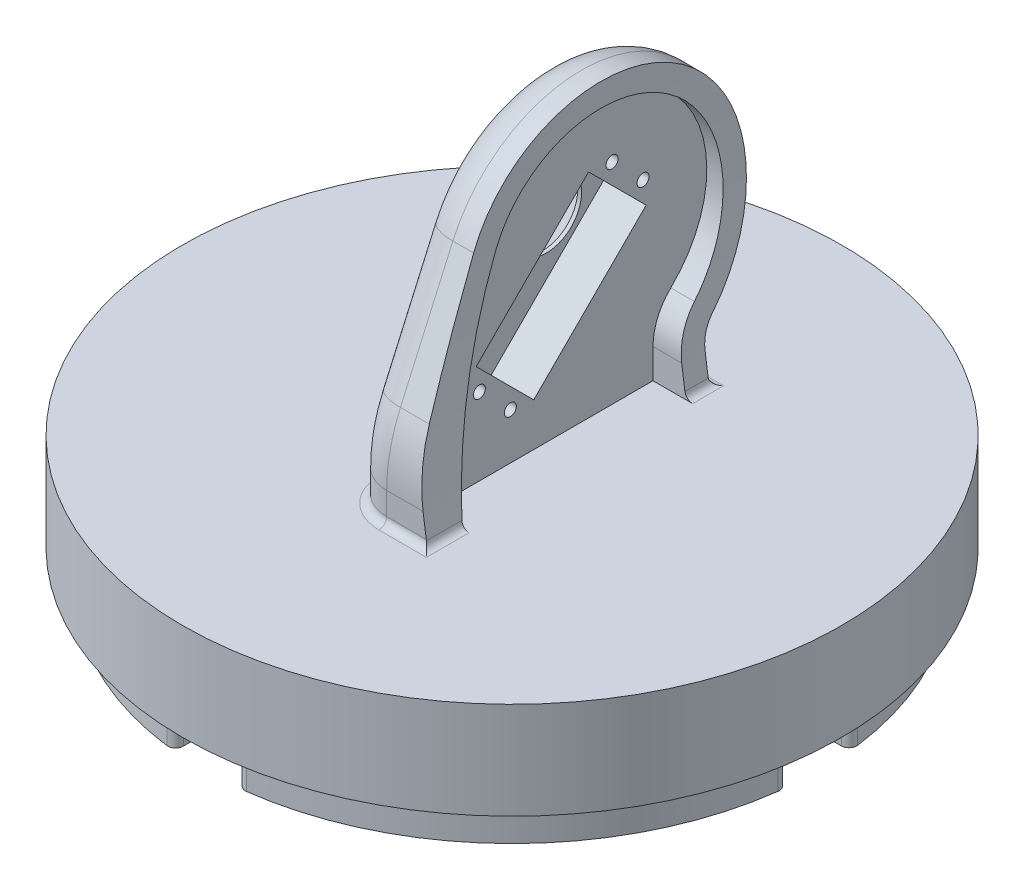
from build123d import *

# Parameters (mm, degrees)
SKETCH1_R                       = 85
BOSS_EXTRUDE1_DEPTH             = 25
BOSS_EXTRUDE2_DEPTH             = 10
FILLET1_R                       = 2
SKETCH3_R                       = 9
BOSS_EXTRUDE3_DEPTH             = 6
CUT_EXTRUDE1_DEPTH              = 151.982311708
CUT_EXTRUDE1_DEPTH_BACK         = 157.982311708
CUT_EXTRUDE1_START              = 6
SKETCH4_R                       = 1.55
BOSS_EXTRUDE5_DEPTH             = 9
BOSS_EXTRUDE5_DIRECTION_2_REACH = 158.982
CUT_EXTRUDE9_DEPTH              = 158.386549836
CUT_EXTRUDE9_DEPTH_BACK         = 158.386549836
FILLET3_R                       = 10
FILLET4_R                       = 2
FILLET5_R                       = 2
CUT_EXTRUDE11_DEPTH             = 11


with BuildPart() as part:
    # Sketch1 → Boss-Extrude1 (new body)
    with BuildSketch(Plane(origin=(0, 0, 0), x_dir=(1, 0, 0), z_dir=(0, 1, 0))):
        with Locations(Location((0, 0, 0), (0, 0, 270))):
            Circle(SKETCH1_R)
    extrude(amount=BOSS_EXTRUDE1_DEPTH)

    # Sketch2 → Boss-Extrude2 (add)
    with BuildSketch(Plane.XZ):
        with BuildLine():
            Line((-7.937838503, 79.102722582), (-7.943370347, 72.063533549))
            ThreePointArc((-7.943370347, 72.063533549), (-51.22493832, 51.305513292), (-72.050959732, 8.056624713))
            Line((-72.050959732, 8.056624713), (-79.090148765, 8.062156557))
            ThreePointArc((-79.090148765, 8.062156557), (-56.170794433, 56.259149058), (-7.937838503, 79.102722582))
        make_face()
        with BuildLine():
            Line((-79.102722582, -7.937838503), (-72.063533549, -7.943370347))
            ThreePointArc((-72.063533549, -7.943370347), (-51.305513292, -51.22493832), (-8.056624713, -72.050959732))
            Line((-8.056624713, -72.050959732), (-8.062156557, -79.090148765))
            ThreePointArc((-8.062156557, -79.090148765), (-56.259149058, -56.170794433), (-79.102722582, -7.937838503))
        make_face()
        with BuildLine():
            Line((8.062156557, 79.090148765), (8.056624713, 72.050959732))
            ThreePointArc((8.056624713, 72.050959732), (51.305513292, 51.22493832), (72.063533549, 7.943370347))
            Line((72.063533549, 7.943370347), (79.102722582, 7.937838503))
            ThreePointArc((79.102722582, 7.937838503), (56.259149058, 56.170794433), (8.062156557, 79.090148765))
        make_face()
        with BuildLine():
            Line((72.050959732, -8.056624713), (79.090148765, -8.062156557))
            ThreePointArc((79.090148765, -8.062156557), (56.170794433, -56.259149058), (7.937838503, -79.102722582))
            Line((7.937838503, -79.102722582), (7.943370347, -72.063533549))
            ThreePointArc((7.943370347, -72.063533549), (51.22493832, -51.305513292), (72.050959732, -8.056624713))
        make_face()
    extrude(amount=BOSS_EXTRUDE2_DEPTH)

    # Fillet1
    fillet1_edges = [part.edges().sort_by_distance(p)[0] for p in [
        (79.102722582, -5, 7.937838503),
        (8.062156557, -5, 79.090148765),
        (8.056624713, -5, 72.050959732),
        (72.063533549, -5, 7.943370347),
        (7.937838503, -5, -79.102722582),
        (79.090148765, -5, -8.062156557),
        (72.050959732, -5, -8.056624713),
        (7.943370347, -5, -72.063533549),
        (-79.102722582, -5, -7.937838503),
        (-8.062156557, -5, -79.090148765),
        (-8.056624713, -5, -72.050959732),
        (-72.063533549, -5, -7.943370347),
        (-7.937838503, -5, 79.102722582),
        (-79.090148765, -5, 8.062156557),
        (-72.050959732, -5, 8.056624713),
        (-7.943370347, -5, 72.063533549),
    ]]
    fillet(fillet1_edges, radius=FILLET1_R)

    # Sketch3 → Boss-Extrude3 (add, symmetric)
    with BuildSketch(Plane(origin=(0, 0, 0), x_dir=(0, 0, -1), z_dir=(1, 0, 0))):
        with BuildLine():
            Line((30.34, 25), (-30.34, 25))
            Line((-30.34, 25), (-30.34, 32.86))
            ThreePointArc((-30.34, 32.86), (-29.573250676, 40.170078852), (-27.306377926, 47.161963097))
            Line((-27.306377926, 47.161963097), (-13.792799414, 77.583540747))
            ThreePointArc((-13.792799414, 77.583540747), (31.301699468, 90.103510982), (34.93507351, 43.444513166))
            ThreePointArc((34.93507351, 43.444513166), (31.536487814, 38.51052394), (30.34, 32.64))
            Line((30.34, 32.64), (30.34, 25))
        make_face()
        with Locations((13.908912319, 65.278154724)):
            Circle(SKETCH3_R, mode=Mode.SUBTRACT)
    extrude(amount=BOSS_EXTRUDE3_DEPTH, both=True)

    # Sketch4 → Cut-Extrude1 (cut, two sides: drawn at the far end of the back side and taken through both)
    with BuildSketch(Plane(origin=(6, 0, 0), x_dir=(0, 0, -1), z_dir=(1, 0, 0)).offset(CUT_EXTRUDE1_START - CUT_EXTRUDE1_DEPTH_BACK)):
        with Locations(Location((27.76820523, 71.147141008, 0), (0, 0, 180))):
            Circle(SKETCH4_R)
        with Locations(Location((19.777898603, 79.137447635, 0), (0, 0, 180))):
            Circle(SKETCH4_R)
        with Locations(Location((-6.455762979, 36.923172798, 0), (0, 0, 180))):
            Circle(SKETCH4_R)
        with Locations(Location((-14.446069607, 44.913479426, 0), (0, 0, 180))):
            Circle(SKETCH4_R)
    extrude(amount=CUT_EXTRUDE1_DEPTH + CUT_EXTRUDE1_DEPTH_BACK, mode=Mode.SUBTRACT)

    # Sketch7 → Boss-Extrude5 (add)
    with BuildSketch(Plane(origin=(6, 0, 0), x_dir=(0, 0, -1), z_dir=(1, 0, 0))):
        with BuildLine():
            Line((36.34, 25), (36.34, 32.64))
            ThreePointArc((36.34, 32.64), (37.057892688, 36.162314364), (39.097044106, 39.122707899))
            ThreePointArc((39.097044106, 39.122707899), (34.744470977, 95.01750369), (-19.276145073, 80.019299435))
            Line((-19.276145073, 80.019299435), (-32.789723585, 49.597721785))
            ThreePointArc((-32.789723585, 49.597721785), (-35.442666062, 41.415053962), (-36.34, 32.86))
            Line((-36.34, 32.86), (-36.34, 25))
            Line((-36.34, 25), (-27.34, 25))
            ThreePointArc((-27.34, 25), (-22.752054714, 51.854864954), (-13.792799414, 77.583540747))
            ThreePointArc((-13.792799414, 77.583540747), (31.301699468, 90.103510982), (34.93507351, 43.444513166))
            ThreePointArc((34.93507351, 43.444513166), (31.536487814, 38.51052394), (30.34, 32.64))
            Line((30.34, 32.64), (30.34, 25))
            Line((30.34, 25), (36.34, 25))
        make_face()
    extrude(amount=BOSS_EXTRUDE5_DEPTH)

    # Boss-Extrude5 direction 2: up to this face of the body (flat: up to its plane)
    boss_extrude5_direction_2_end = Plane(part.part.faces().sort_by_distance((-6, 56.749631144, -7.806138982))[0])
    # Sketch7 → Boss-Extrude5 direction 2 (add, up to the picked face)
    with BuildSketch(Plane(origin=(6, 0, 0), x_dir=(0, 0, -1), z_dir=(1, 0, 0)), mode=Mode.PRIVATE) as boss_extrude5_direction_2_sk1:
        with BuildLine():
            Line((36.34, 25), (36.34, 32.64))
            ThreePointArc((36.34, 32.64), (37.057892688, 36.162314364), (39.097044106, 39.122707899))
            ThreePointArc((39.097044106, 39.122707899), (34.744470977, 95.01750369), (-19.276145073, 80.019299435))
            Line((-19.276145073, 80.019299435), (-32.789723585, 49.597721785))
            ThreePointArc((-32.789723585, 49.597721785), (-35.442666062, 41.415053962), (-36.34, 32.86))
            Line((-36.34, 32.86), (-36.34, 25))
            Line((-36.34, 25), (-27.34, 25))
            ThreePointArc((-27.34, 25), (-22.752054714, 51.854864954), (-13.792799414, 77.583540747))
            ThreePointArc((-13.792799414, 77.583540747), (31.301699468, 90.103510982), (34.93507351, 43.444513166))
            ThreePointArc((34.93507351, 43.444513166), (31.536487814, 38.51052394), (30.34, 32.64))
            Line((30.34, 32.64), (30.34, 25))
            Line((30.34, 25), (36.34, 25))
        make_face()
    boss_extrude5_direction_2_tool1 = split(extrude(boss_extrude5_direction_2_sk1.sketch, amount=-BOSS_EXTRUDE5_DIRECTION_2_REACH, mode=Mode.PRIVATE), bisect_by=boss_extrude5_direction_2_end, keep=Keep.BOTH, mode=Mode.PRIVATE)
    add(boss_extrude5_direction_2_tool1.solids().sort_by(Axis((6, 91.050112, -31.964893), (-1, 0, 0)))[0])

    # Sketch8 → Cut-Extrude9 (cut, two sides: drawn at the far end of the back side and taken through both)
    with BuildSketch(Plane.XY.offset(-CUT_EXTRUDE9_DEPTH_BACK)):
        with BuildLine():
            Line((15, 101.589990006), (9, 101.589990006))
            ThreePointArc((9, 101.589990006), (10.277543258, 63.189256484), (14.5, 25))
            Line((14.5, 25), (15, 25))
            Line((15, 25), (15, 101.589990006))
        make_face()
    extrude(amount=CUT_EXTRUDE9_DEPTH + CUT_EXTRUDE9_DEPTH_BACK, mode=Mode.SUBTRACT)

    # Fillet3
    fillet3_edges = [part.edges().sort_by_distance(p)[0] for p in [
        (-6, 28.82, -36.34),
        (-6, 36.162314364, -37.057892688),
        (-6, 95.01750369, -34.744470977),
        (-6, 64.80851061, 26.032934329),
        (-6, 41.415053962, 35.442666062),
        (-6, 28.93, 36.34),
    ]]
    fillet(fillet3_edges, radius=FILLET3_R)

    # Fillet4
    fillet4_edges = [part.edges().sort_by_distance(p)[0] for p in [
        (9.25, 25, -36.34),
        (-6, 25, 0),
        (9.25, 25, 36.34),
        (-3.071067812, 25, -33.411067812),
        (-3.071067812, 25, 33.411067812),
    ]]
    fillet(fillet4_edges, radius=FILLET4_R)

    # Fillet5
    fillet5_edges = [part.edges().sort_by_distance(p)[0] for p in [
        (14.5, 25, -34.34),
        (14.5, 25, 32.84),
    ]]
    fillet(fillet5_edges, radius=FILLET5_R)

    # Sketch4<3> → Cut-Extrude11 (cut)
    with BuildSketch(Plane(origin=(6, 0, 0), x_dir=(0, 0, -1), z_dir=(1, 0, 0))):
        Polygon((-0.41, 36.11), (28.581378029, 65.101378029), (13.732135624, 79.950620434), (-15.259242405, 50.959242405), align=None)
    extrude(amount=-CUT_EXTRUDE11_DEPTH, mode=Mode.SUBTRACT)


solid = part.part
